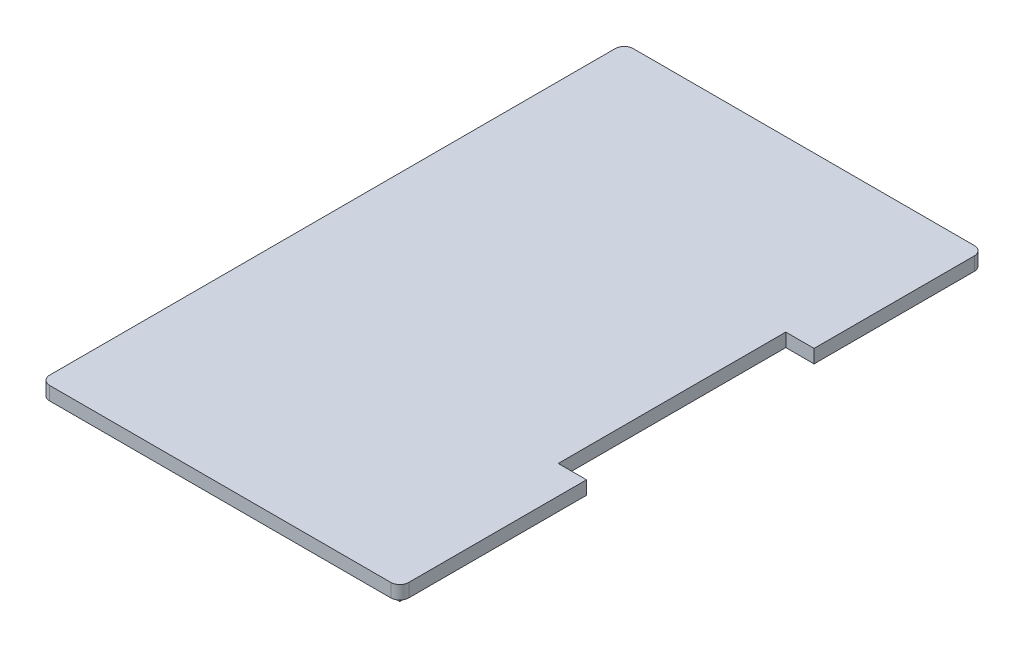
from build123d import *

# Parameters (mm, degrees)
BOSS_EXTRUDE1_DEPTH = 1.5
BOSS_EXTRUDE2_DEPTH = 1.5
FILLET1_R           = 1


with BuildPart() as part:
    # Sketch1 → Boss-Extrude1 (new body)
    with BuildSketch(Plane(origin=(0, 0, 0), x_dir=(1, 0, 0), z_dir=(0, 1, 0))):
        Polygon((19.382239382, 38.721878286), (-20.617760618, 38.721878286), (-20.617760618, -26.278121714), (19.382239382, -26.278121714), (19.382239382, -5.478121714), (16.232239382, -5.478121714), (16.232239382, 19.871878286), (19.382239382, 19.871878286), align=None)
    extrude(amount=BOSS_EXTRUDE1_DEPTH)

    # Sketch2 → Boss-Extrude2 (add)
    with BuildSketch(Plane.XZ):
        Polygon((-18.967760618, 24.628121714), (17.732239382, 24.628121714), (17.732239382, 7.128121714), (14.582239382, 7.128121714), (14.582239382, -21.521878286), (17.732239382, -21.521878286), (17.732239382, -37.071878286), (-18.967760618, -37.071878286), align=None)
        Polygon((-17.467760618, 23.128121714), (-17.467760618, -35.571878286), (16.232239382, -35.571878286), (16.232239382, -23.021878286), (13.082239382, -23.021878286), (13.082239382, 8.628121714), (16.232239382, 8.628121714), (16.232239382, 23.128121714), align=None, mode=Mode.SUBTRACT)
    extrude(amount=BOSS_EXTRUDE2_DEPTH)

    # Fillet1
    fillet1_edges = [part.edges().sort_by_distance(p)[0] for p in [
        (19.382239382, 0.75, 26.278121714),
        (-20.617760618, 0.75, 26.278121714),
        (-20.617760618, 0.75, -38.721878286),
        (19.382239382, 0.75, -38.721878286),
    ]]
    fillet(fillet1_edges, radius=FILLET1_R)


solid = part.part
